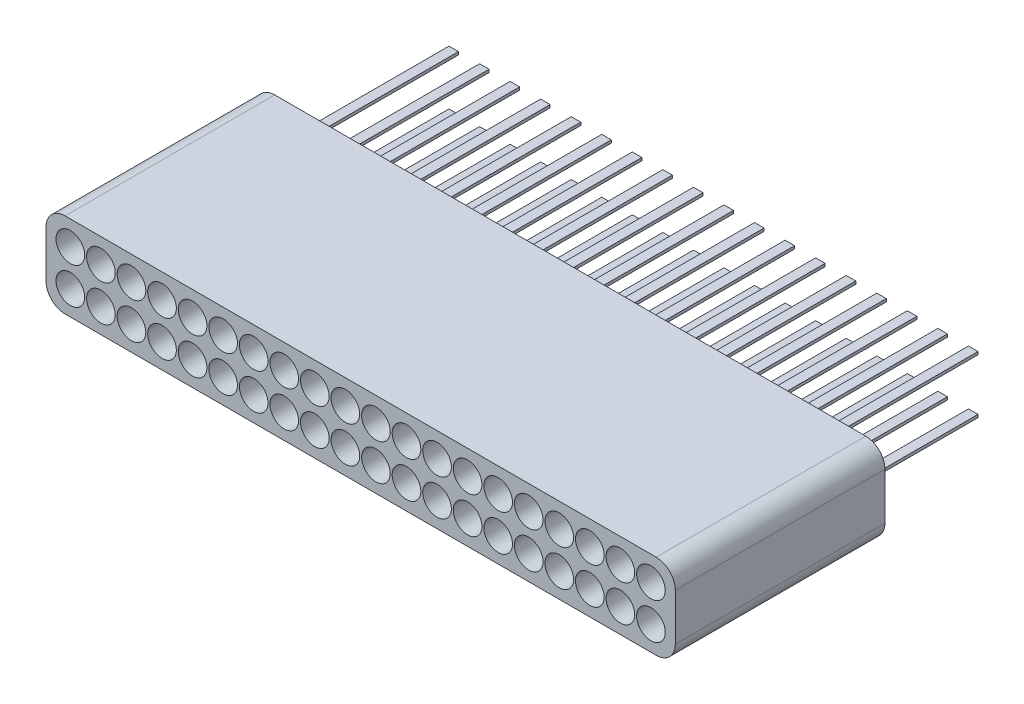
from build123d import *

# Parameters (mm, degrees)
SKETCH1_W            = 13.18
SKETCH1_H            = 1.78
BOSS_EXTRUDE1_DEPTH  = 4.39
SKETCH2_W            = 0.2
SKETCH2_H            = 0.06
BOSS_EXTRUDE2_DEPTH  = 3
LPATTERN2_COUNT      = 18
LPATTERN2_PITCH      = 0.64
LPATTERN2_COUNT_DIR2 = 2
LPATTERN2_PITCH_DIR2 = 1.14
SKETCH3_R            = 0.3
CUT_EXTRUDE1_DEPTH   = 3
LPATTERN1_COUNT      = 20
LPATTERN1_PITCH      = 0.64
LPATTERN1_COUNT_DIR2 = 2
LPATTERN1_PITCH_DIR2 = 0.76
FILLET1_R            = 0.4


with BuildPart() as part:
    # Sketch1 → Boss-Extrude1 (new body)
    with BuildSketch(Plane.XY):
        Rectangle(SKETCH1_W, SKETCH1_H)
    extrude(amount=BOSS_EXTRUDE1_DEPTH)

    # Sketch2 → Boss-Extrude2 (add)
    with BuildSketch(Plane.XY):
        with Locations((5.44, 0.57)):
            Rectangle(SKETCH2_W, SKETCH2_H)
    boss_extrude2 = extrude(amount=-BOSS_EXTRUDE2_DEPTH)

    # LPattern2: Boss-Extrude2 18 × 2
    with Locations(*[(-i * LPATTERN2_PITCH, -j * LPATTERN2_PITCH_DIR2, 0) for i in range(LPATTERN2_COUNT) for j in range(LPATTERN2_COUNT_DIR2) if (i, j) != (0, 0)]):
        add(boss_extrude2)

    # Sketch3 → Cut-Extrude1 (cut)
    with BuildSketch(Plane.XY.offset(4.39)):
        with Locations((6.08, -0.38)):
            Circle(SKETCH3_R)
    cut_extrude1 = extrude(amount=-CUT_EXTRUDE1_DEPTH, mode=Mode.SUBTRACT)

    # LPattern1: Cut-Extrude1 20 × 2
    with Locations(*[(-i * LPATTERN1_PITCH, j * LPATTERN1_PITCH_DIR2, 0) for i in range(LPATTERN1_COUNT) for j in range(LPATTERN1_COUNT_DIR2) if (i, j) != (0, 0)]):
        add(cut_extrude1, mode=Mode.SUBTRACT)

    # Fillet1
    fillet1_edges = [part.edges().sort_by_distance(p)[0] for p in [
        (-6.59, 0.89, 2.195),
        (6.59, 0.89, 2.195),
        (6.59, -0.89, 2.195),
        (-6.59, -0.89, 2.195),
    ]]
    fillet(fillet1_edges, radius=FILLET1_R)


solid = part.part
